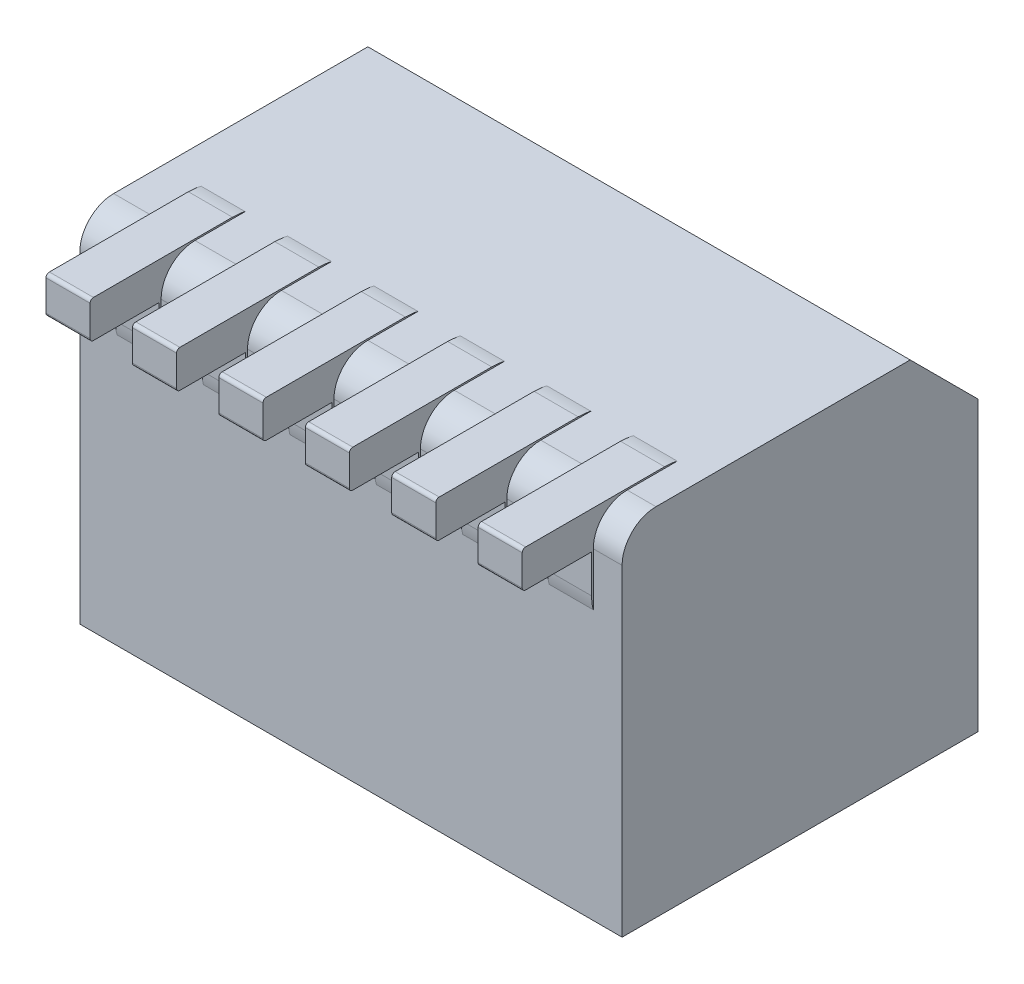
from build123d import *

# Parameters (mm, degrees)
BOSS_EXTRUDE1_DEPTH = 8
BOSS_EXTRUDE2_START = -1.5
BOSS_EXTRUDE2_DEPTH = 0.65
LPATTERN1_COUNT     = 6
LPATTERN1_PITCH     = 2.55


with BuildPart() as part:
    # Sketch1 → Boss-Extrude1 (new, symmetric)
    with BuildSketch(Plane(origin=(0, 0, 0), x_dir=(0, 0, -1), z_dir=(1, 0, 0))):
        with BuildLine():
            Line((3.25, 5.25), (5.25, 3.25))
            Line((5.25, 3.25), (5.25, -5.25))
            Line((5.25, -5.25), (-5.25, -5.25))
            Line((-5.25, -5.25), (-5.25, 4.25))
            ThreePointArc((-5.25, 4.25), (-4.957106781, 4.957106781), (-4.25, 5.25))
            Line((-4.25, 5.25), (3.25, 5.25))
        make_face()
    extrude(amount=BOSS_EXTRUDE1_DEPTH, both=True)


with BuildPart() as body_2:
    # Sketch2 → Boss-Extrude2 (new, symmetric)
    with BuildSketch(Plane(origin=(8, 0, 0), x_dir=(0, 0, -1), z_dir=(1, 0, 0)).offset(BOSS_EXTRUDE2_START)):
        with BuildLine():
            Line((-3.146046955, 5.294720649), (-7.246046955, 5.294720649))
            ThreePointArc((-7.246046955, 5.294720649), (-7.316757633, 5.265431328), (-7.346046955, 5.194720649))
            Line((-7.346046955, 5.194720649), (-7.346046955, 4.294720649))
            ThreePointArc((-7.346046955, 4.294720649), (-7.316757633, 4.224009971), (-7.246046955, 4.194720649))
            Line((-7.246046955, 4.194720649), (-5.309658496, 4.194720649))
            Line((-5.309658496, 4.194720649), (-5.307595735, 3.078583572))
            ThreePointArc((-5.307595735, 3.078583572), (-1.66693306, 1.689819467), (-3.146046955, 5.294720649))
        make_face()
    boss_extrude2 = extrude(amount=BOSS_EXTRUDE2_DEPTH, both=True)


with BuildPart() as lpattern1_1:
    # LPattern1: Boss-Extrude2 ×6
    with Locations(*[(-i * LPATTERN1_PITCH, 0, 0) for i in range(1, LPATTERN1_COUNT)]):
        add(boss_extrude2)


solid = Compound([part.part, body_2.part, lpattern1_1.part])
